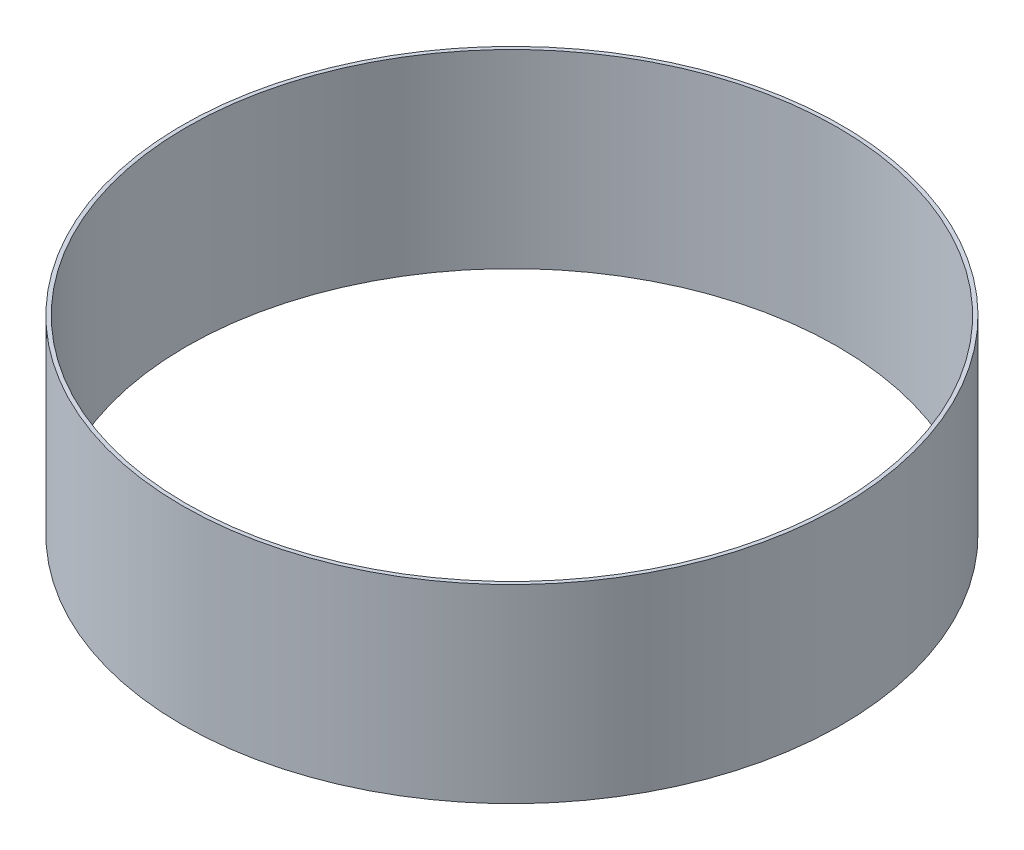
from build123d import *

# Parameters (mm, degrees)
SKETCH1_W = 1.524
SKETCH1_H = 76.2


with BuildPart() as part:
    # Sketch1 → Revolve1 (revolve)
    with BuildSketch(Plane.XY, mode=Mode.PRIVATE) as revolve1_sk:
        with Locations((131.572, 38.1)):
            Rectangle(SKETCH1_W, SKETCH1_H)
    revolve(revolve1_sk.sketch.rotate(Axis((0, 91.746766452, 0), (0, -1, 0)), 90), axis=Axis((0, 91.746766452, 0), (0, -1, 0)))


solid = part.part
